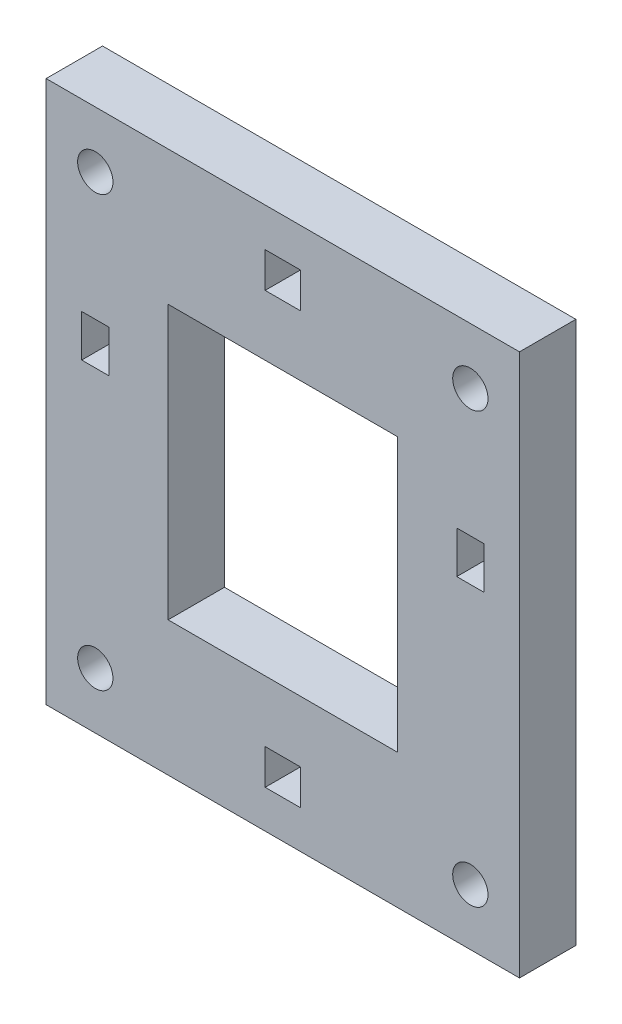
from build123d import *

# Parameters (mm, degrees)
SKETCH_1_W          = 69.7
SKETCH_1_H          = 79.85
SKETCH_1_R          = 2.6
SKETCH_1_W_2        = 33.78
SKETCH_1_H_2        = 40.24
SKETCH_1_W_3        = 4
SKETCH_1_H_3        = 6.2
EXTRUDE_1_DEPTH     = 8.3
SKETCH_3_W          = 5.2
SKETCH_3_H          = 5.2
CUT_EXTRUDE_1_DEPTH = 10
SKETCH_5_W          = 5.2
SKETCH_5_H          = 5.2
CUT_EXTRUDE_2_DEPTH = 10


with BuildPart() as part:
    # Эскиз1 → Бобышка-Вытянуть1 (new body)
    with BuildSketch(Plane.XY):
        with Locations((-0.085003009, 0)):
            Rectangle(SKETCH_1_W, SKETCH_1_H)
        with Locations(Location((-27.697888562, 31.633987252, 0), (0, 0, 180))):
            Circle(SKETCH_1_R, mode=Mode.SUBTRACT)
        with Locations(Location((-27.697888562, -31.633987252, 0), (0, 0, 180))):
            Circle(SKETCH_1_R, mode=Mode.SUBTRACT)
        with Locations(Location((27.527882545, -31.633987252, 0), (0, 0, 180))):
            Circle(SKETCH_1_R, mode=Mode.SUBTRACT)
        with Locations(Location((27.527882545, 31.633987252, 0), (0, 0, 180))):
            Circle(SKETCH_1_R, mode=Mode.SUBTRACT)
        with Locations((-0.085003009, 0)):
            Rectangle(SKETCH_1_W_2, SKETCH_1_H_2, mode=Mode.SUBTRACT)
        with Locations((-27.697888562, 9.743987252)):
            Rectangle(SKETCH_1_W_3, SKETCH_1_H_3, mode=Mode.SUBTRACT)
        with Locations((27.527882545, 9.743987252)):
            Rectangle(SKETCH_1_W_3, SKETCH_1_H_3, mode=Mode.SUBTRACT)
    extrude(amount=EXTRUDE_1_DEPTH)

    # Эскиз3 → Вырез-Вытянуть1 (cut)
    with BuildSketch(Plane.XY.offset(8.3)):
        with Locations((-0.085003009, -31.733803261)):
            Rectangle(SKETCH_3_W, SKETCH_3_H)
    extrude(amount=-CUT_EXTRUDE_1_DEPTH, mode=Mode.SUBTRACT)

    # Эскиз5 → Вырез-Вытянуть2 (cut)
    with BuildSketch(Plane.XY.offset(8.3)):
        with Locations((-0.085003009, 31.633987252)):
            Rectangle(SKETCH_5_W, SKETCH_5_H)
    extrude(amount=-CUT_EXTRUDE_2_DEPTH, mode=Mode.SUBTRACT)


solid = part.part
